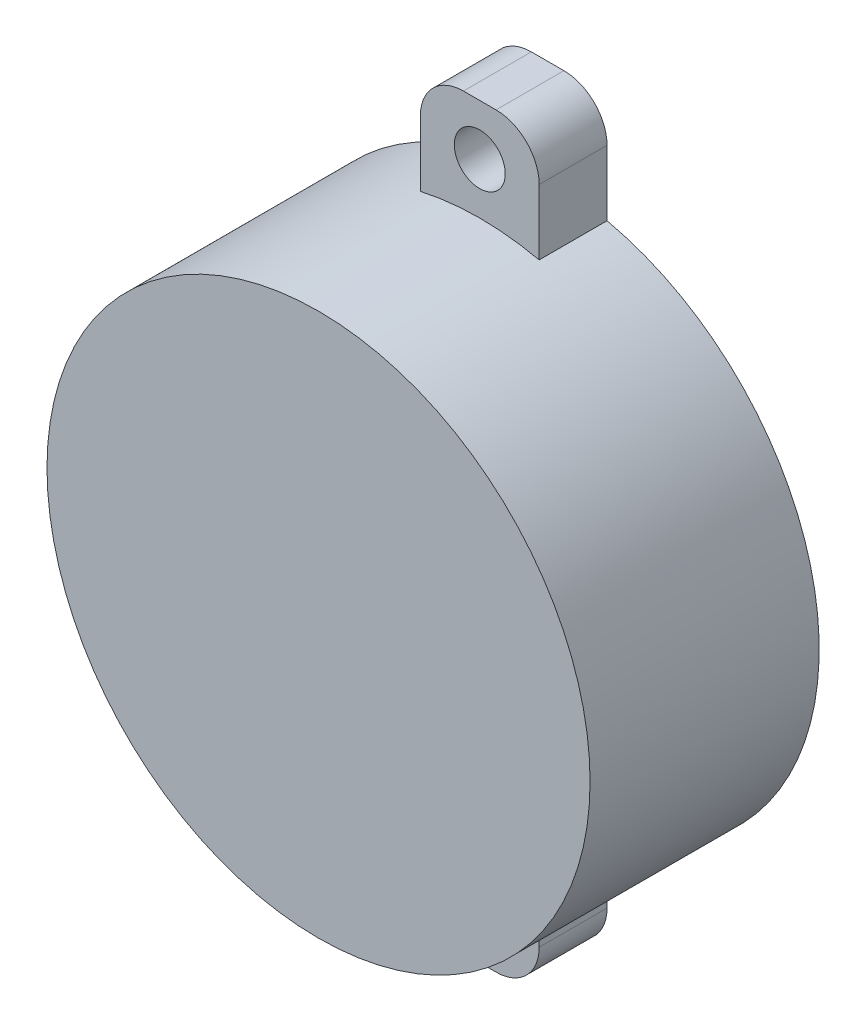
from build123d import *

# Parameters (mm, degrees)
SKETCH1_R           = 16
BOSS_EXTRUDE1_DEPTH = 13.5
SKETCH2_W           = 7
SKETCH2_H           = 44
BOSS_EXTRUDE2_DEPTH = 4
FILLET1_R           = 2.54
SKETCH4_R           = 1.5
CUT_EXTRUDE1_DEPTH  = 31.368569278


with BuildPart() as part:
    # Sketch1 → Boss-Extrude1 (new body)
    with BuildSketch(Plane.XY):
        Circle(SKETCH1_R)
    extrude(amount=BOSS_EXTRUDE1_DEPTH)

    # Sketch2 → Boss-Extrude2 (add)
    with BuildSketch(Plane(origin=(0, 0, 0), x_dir=(-1, 0, 0), z_dir=(0, 0, -1))):
        Rectangle(SKETCH2_W, SKETCH2_H)
    extrude(amount=-BOSS_EXTRUDE2_DEPTH)

    # Fillet1
    fillet1_edges = [part.edges().sort_by_distance(p)[0] for p in [
        (-3.5, 22, 2),
        (3.5, -22, 2),
        (-3.5, -22, 2),
        (3.5, 22, 2),
    ]]
    fillet(fillet1_edges, radius=FILLET1_R)

    # Sketch4 → Cut-Extrude1 (cut, through all)
    with BuildSketch(Plane(origin=(0, 0, 0), x_dir=(-1, 0, 0), z_dir=(0, 0, -1))):
        with Locations((0, -19)):
            Circle(SKETCH4_R)
    cut_extrude1 = extrude(amount=-CUT_EXTRUDE1_DEPTH, mode=Mode.SUBTRACT)

    # Mirror1: Cut-Extrude1 across plane
    add(cut_extrude1.mirror(Plane.ZX), mode=Mode.SUBTRACT)


solid = part.part
